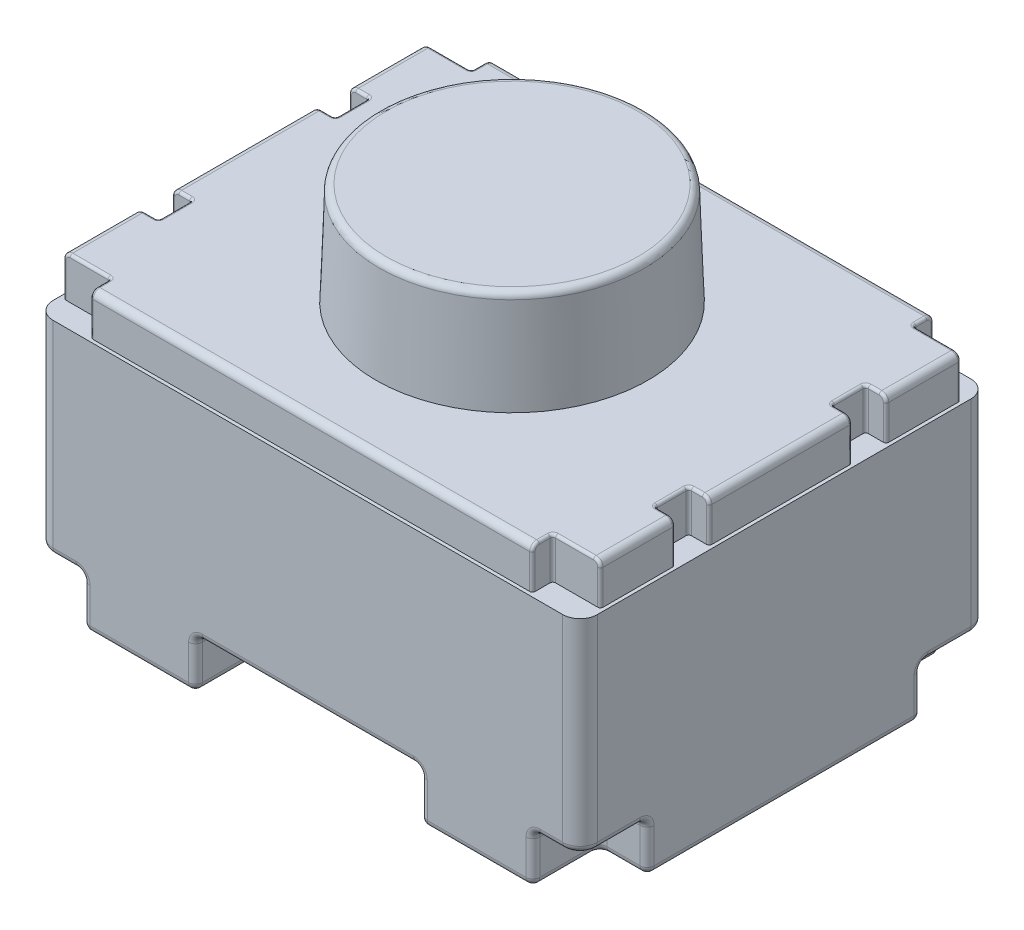
from build123d import *

# Parameters (mm, degrees)
BOSS_EXTRUDE1_START = 0.5588
SKETCH1_W           = 4
SKETCH1_H           = 3
BOSS_EXTRUDE1_DEPTH = 1.5
FILLET1_R           = 0.127
BOSS_EXTRUDE2_DEPTH = 0.3048
BOSS_EXTRUDE3_REACH = 5.64
BOSS_EXTRUDE3_START = 0.2
SKETCH5_R           = 1
BOSS_EXTRUDE5_DEPTH = 0.75
BOSS_EXTRUDE5_TAPER = 2
FILLET3_R           = 0.0508
CUT_EXTRUDE1_START  = -0.3048
SKETCH6_W           = 0.15
SKETCH6_H           = 0.25
CUT_EXTRUDE1_DEPTH  = 0.3048
FILLET4_R           = 0.02
FILLET5_R           = 0.05


with BuildPart() as part:
    # Sketch1 → Boss-Extrude1 (new body)
    with BuildSketch(Plane(origin=(0, 0, 0), x_dir=(1, 0, 0), z_dir=(0, 1, 0)).offset(BOSS_EXTRUDE1_START)):
        Rectangle(SKETCH1_W, SKETCH1_H)
    extrude(amount=BOSS_EXTRUDE1_DEPTH)

    # Fillet1
    fillet1_edges = [part.edges().sort_by_distance(p)[0] for p in [
        (2, 1.3088, 1.5),
        (-2, 1.3088, 1.5),
        (-2, 1.3088, -1.5),
        (2, 1.3088, -1.5),
    ]]
    fillet(fillet1_edges, radius=FILLET1_R)

    # Sketch2 → Boss-Extrude2 (add)
    with BuildSketch(Plane(origin=(0, 2.0588, 0), x_dir=(-1, 0, 0), z_dir=(0, -1, 0))):
        with BuildLine():
            Line((1.9746, -1.373), (1.9746, 1.373))
            ThreePointArc((1.9746, 1.373), (1.944842049, 1.444842049), (1.873, 1.4746))
            Line((1.873, 1.4746), (-1.873, 1.4746))
            ThreePointArc((-1.873, 1.4746), (-1.944842049, 1.444842049), (-1.9746, 1.373))
            Line((-1.9746, 1.373), (-1.9746, -1.373))
            ThreePointArc((-1.9746, -1.373), (-1.944842049, -1.444842049), (-1.873, -1.4746))
            Line((-1.873, -1.4746), (1.873, -1.4746))
            ThreePointArc((1.873, -1.4746), (1.944842049, -1.444842049), (1.9746, -1.373))
        make_face()
    extrude(amount=-BOSS_EXTRUDE2_DEPTH)

    # Sketch3 → Boss-Extrude3 (add, up to next)
    with BuildSketch(Plane(origin=(0, 0, 0), x_dir=(1, 0, 0), z_dir=(0, 1, 0)).offset(BOSS_EXTRUDE3_START), mode=Mode.PRIVATE) as boss_extrude3_sk1:
        Polygon((-1.65323541, -1.5), (-1.65323541, -1.006902093), (-2, -1.006902093), (-2, 1.006902093), (-1.65323541, 1.006902093), (-1.65323541, 1.5), (-0.826439501, 1.5), (-0.826439501, 0.473804959), (-1.582835796, 0.473804959), (-1.582835796, -0.473804959), (-0.826439501, -0.473804959), (-0.826439501, -1.5), align=None)
    boss_extrude3_tool1 = extrude(boss_extrude3_sk1.sketch, amount=BOSS_EXTRUDE3_REACH, mode=Mode.PRIVATE) - part.part
    # Sketch3 → Boss-Extrude3 (add, up to next)
    with BuildSketch(Plane(origin=(0, 0, 0), x_dir=(1, 0, 0), z_dir=(0, 1, 0)).offset(BOSS_EXTRUDE3_START), mode=Mode.PRIVATE) as boss_extrude3_sk2:
        Polygon((1.65323541, 1.5), (1.65323541, 1.006902093), (2, 1.006902093), (2, -1.006902093), (1.65323541, -1.006902093), (1.65323541, -1.5), (0.826439501, -1.5), (0.826439501, -0.473804959), (1.582835796, -0.473804959), (1.582835796, 0.473804959), (0.826439501, 0.473804959), (0.826439501, 1.5), align=None)
    boss_extrude3_tool2 = extrude(boss_extrude3_sk2.sketch, amount=BOSS_EXTRUDE3_REACH, mode=Mode.PRIVATE) - part.part
    add(boss_extrude3_tool1.solids().sort_by_distance((-1.621022, 0.2, 1.253451))[0])
    add(boss_extrude3_tool2.solids().sort_by_distance((1.621022, 0.2, -1.253451))[0])

    # Sketch5 → Boss-Extrude5 (add)
    with BuildSketch(Plane(origin=(0, 2.3636, 0), x_dir=(1, 0, 0), z_dir=(0, 1, 0))):
        Circle(SKETCH5_R)
    extrude(amount=BOSS_EXTRUDE5_DEPTH, taper=BOSS_EXTRUDE5_TAPER)

    # Fillet3
    fillet3_edges = [part.edges().sort_by_distance(p)[0] for p in [
        (0.826439501, 0.5588, -0.98690248),
        (0.826439501, 0.3794, -1.5),
        (0.826439501, 0.2, -0.98690248),
        (1.204637649, 0.5588, -0.473804959),
        (0.826439501, 0.3794, -0.473804959),
        (1.204637649, 0.2, -0.473804959),
        (1.582835796, 0.5588, 0),
        (1.582835796, 0.3794, -0.473804959),
        (1.582835796, 0.2, 0),
        (1.204637649, 0.5588, 0.473804959),
        (1.582835796, 0.3794, 0.473804959),
        (1.204637649, 0.2, 0.473804959),
        (0.826439501, 0.5588, 0.98690248),
        (0.826439501, 0.3794, 0.473804959),
        (0.826439501, 0.2, 0.98690248),
        (0.826439501, 0.3794, 1.5),
        (1.239837456, 0.2, 1.5),
        (1.65323541, 0.5588, 1.253451047),
        (1.65323541, 0.3794, 1.5),
        (1.65323541, 0.2, 1.253451047),
        (1.826617705, 0.5588, 1.006902093),
        (1.65323541, 0.3794, 1.006902093),
        (1.826617705, 0.2, 1.006902093),
        (2, 0.3794, 1.006902093),
        (2, 0.2, 0),
        (1.826617705, 0.5588, -1.006902093),
        (2, 0.3794, -1.006902093),
        (1.826617705, 0.2, -1.006902093),
        (1.65323541, 0.3794, -1.5),
        (1.239837456, 0.2, -1.5),
        (1.65323541, 0.5588, -1.253451047),
        (1.65323541, 0.3794, -1.006902093),
        (1.65323541, 0.2, -1.253451047),
        (-1.763117705, 0.5588, 1.5),
        (2, 0.5588, 1.189951047),
        (-2, 0.5588, -1.189951047),
        (1.763117705, 0.5588, -1.5),
        (1.962802561, 0.5588, 1.462802561),
        (1.962802561, 0.5588, -1.462802561),
        (-1.962802561, 0.5588, -1.462802561),
        (-1.962802561, 0.5588, 1.462802561),
        (-1.944842049, 2.3636, 1.444842049),
        (0, 2.3636, 1.4746),
        (1.944842049, 2.3636, 1.444842049),
        (1.9746, 2.3636, 0),
        (1.944842049, 2.3636, -1.444842049),
        (0, 2.3636, -1.4746),
        (-1.944842049, 2.3636, -1.444842049),
        (-1.9746, 2.3636, 0),
        (0, 0.5588, 1.5),
        (-2, 0.5588, 1.189951047),
        (-1.763117705, 0.5588, -1.5),
        (-0.826439501, 0.5588, 0.98690248),
        (-0.826439501, 0.3794, 1.5),
        (-0.826439501, 0.2, 0.98690248),
        (-1.204637649, 0.5588, 0.473804959),
        (-0.826439501, 0.3794, 0.473804959),
        (-1.204637649, 0.2, 0.473804959),
        (-1.582835796, 0.5588, 0),
        (-1.582835796, 0.3794, 0.473804959),
        (-1.582835796, 0.2, 0),
        (-1.204637649, 0.5588, -0.473804959),
        (-1.582835796, 0.3794, -0.473804959),
        (-1.204637649, 0.2, -0.473804959),
        (-0.826439501, 0.5588, -0.98690248),
        (-0.826439501, 0.3794, -0.473804959),
        (-0.826439501, 0.2, -0.98690248),
        (-0.826439501, 0.3794, -1.5),
        (-1.239837456, 0.2, -1.5),
        (-1.65323541, 0.5588, -1.253451047),
        (-1.65323541, 0.3794, -1.5),
        (-1.65323541, 0.2, -1.253451047),
        (-1.826617705, 0.5588, -1.006902093),
        (-1.65323541, 0.3794, -1.006902093),
        (-1.826617705, 0.2, -1.006902093),
        (-2, 0.3794, -1.006902093),
        (-2, 0.2, 0),
        (-1.826617705, 0.5588, 1.006902093),
        (-2, 0.3794, 1.006902093),
        (-1.826617705, 0.2, 1.006902093),
        (-1.65323541, 0.3794, 1.5),
        (-1.239837456, 0.2, 1.5),
        (-1.65323541, 0.5588, 1.253451047),
        (-1.65323541, 0.3794, 1.006902093),
        (-1.65323541, 0.2, 1.253451047),
        (0, 0.5588, -1.5),
        (2, 0.5588, -1.189951047),
        (1.763117705, 0.5588, 1.5),
    ]]
    fillet(fillet3_edges, radius=FILLET3_R)

    # Sketch6 → Cut-Extrude1 (cut)
    with BuildSketch(Plane(origin=(0, 2.3636, 0), x_dir=(1, 0, 0), z_dir=(0, 1, 0)).offset(CUT_EXTRUDE1_START)):
        with Locations((-1.8996, 0.65)):
            Rectangle(SKETCH6_W, SKETCH6_H)
        with BuildLine():
            Line((-1.6246, 1.3246), (-1.9746, 1.3246))
            Line((-1.9746, 1.3246), (-1.9746, 1.373))
            ThreePointArc((-1.9746, 1.373), (-1.944842049, 1.444842049), (-1.873, 1.4746))
            Line((-1.873, 1.4746), (-1.6246, 1.4746))
            Line((-1.6246, 1.4746), (-1.6246, 1.3246))
        make_face()
        with BuildLine():
            Line((1.9746, 1.3246), (1.9746, 1.373))
            ThreePointArc((1.9746, 1.373), (1.944842049, 1.444842049), (1.873, 1.4746))
            Line((1.873, 1.4746), (1.6246, 1.4746))
            Line((1.6246, 1.4746), (1.6246, 1.3246))
            Line((1.6246, 1.3246), (1.9746, 1.3246))
        make_face()
        with Locations((1.8996, 0.65)):
            Rectangle(SKETCH6_W, SKETCH6_H)
        with Locations((1.8996, -0.65)):
            Rectangle(SKETCH6_W, SKETCH6_H)
        with BuildLine():
            Line((1.6246, -1.3246), (1.9746, -1.3246))
            Line((1.9746, -1.3246), (1.9746, -1.373))
            ThreePointArc((1.9746, -1.373), (1.944842049, -1.444842049), (1.873, -1.4746))
            Line((1.873, -1.4746), (1.6246, -1.4746))
            Line((1.6246, -1.4746), (1.6246, -1.3246))
        make_face()
        with BuildLine():
            Line((-1.9746, -1.3246), (-1.9746, -1.373))
            ThreePointArc((-1.9746, -1.373), (-1.944842049, -1.444842049), (-1.873, -1.4746))
            Line((-1.873, -1.4746), (-1.6246, -1.4746))
            Line((-1.6246, -1.4746), (-1.6246, -1.3246))
            Line((-1.6246, -1.3246), (-1.9746, -1.3246))
        make_face()
        with Locations((-1.8996, -0.65)):
            Rectangle(SKETCH6_W, SKETCH6_H)
    extrude(amount=CUT_EXTRUDE1_DEPTH, mode=Mode.SUBTRACT)

    # Fillet4
    fillet4_edges = [part.edges().sort_by_distance(p)[0] for p in [
        (-1.6246, 2.2112, 1.3246),
        (-1.6246, 2.1858, 1.4746),
        (-1.6246, 2.348721024, 1.459721024),
        (-1.6246, 2.3636, 1.3742),
        (-1.7742, 2.3636, 1.3246),
        (-1.959721024, 2.348721024, 1.3246),
        (-1.9746, 2.1858, 1.3246),
        (-1.9746, 2.1858, 0.525),
        (-1.959721024, 2.348721024, 0.525),
        (-1.8742, 2.3636, 0.525),
        (-1.8246, 2.2112, 0.525),
        (-1.8246, 2.3636, 0.65),
        (-1.8246, 2.2112, 0.775),
        (-1.8742, 2.3636, 0.775),
        (-1.959721024, 2.348721024, 0.775),
        (-1.9746, 2.1858, 0.775),
        (-1.9746, 2.1858, -0.525),
        (-1.959721024, 2.348721024, -0.525),
        (-1.8742, 2.3636, -0.525),
        (-1.8246, 2.2112, -0.525),
        (-1.8246, 2.3636, -0.65),
        (-1.8246, 2.2112, -0.775),
        (-1.8742, 2.3636, -0.775),
        (-1.959721024, 2.348721024, -0.775),
        (-1.9746, 2.1858, -0.775),
        (-1.9746, 2.1858, -1.3246),
        (-1.959721024, 2.348721024, -1.3246),
        (-1.7742, 2.3636, -1.3246),
        (-1.6246, 2.2112, -1.3246),
        (-1.6246, 2.3636, -1.3742),
        (-1.6246, 2.348721024, -1.459721024),
        (-1.6246, 2.1858, -1.4746),
        (1.6246, 2.1858, -1.4746),
        (1.6246, 2.348721024, -1.459721024),
        (1.6246, 2.3636, -1.3742),
        (1.9746, 2.1858, -1.3246),
        (1.959721024, 2.348721024, -1.3246),
        (1.7742, 2.3636, -1.3246),
        (1.6246, 2.2112, -1.3246),
        (1.8246, 2.2112, -0.775),
        (1.9746, 2.1858, -0.775),
        (1.959721024, 2.348721024, -0.775),
        (1.8742, 2.3636, -0.775),
        (1.8246, 2.3636, -0.65),
        (1.9746, 2.1858, -0.525),
        (1.8742, 2.3636, -0.525),
        (1.959721024, 2.348721024, -0.525),
        (1.8246, 2.2112, -0.525),
        (1.9746, 2.1858, 0.525),
        (1.8742, 2.3636, 0.525),
        (1.959721024, 2.348721024, 0.525),
        (1.8246, 2.2112, 0.525),
        (1.8246, 2.3636, 0.65),
        (1.9746, 2.1858, 1.3246),
        (1.6246, 2.1858, 1.4746),
        (1.959721024, 2.348721024, 0.775),
        (1.8742, 2.3636, 0.775),
        (1.8246, 2.2112, 0.775),
        (1.9746, 2.1858, 0.775),
        (1.6246, 2.2112, 1.3246),
        (1.6246, 2.3636, 1.3742),
        (1.7742, 2.3636, 1.3246),
    ]]
    fillet(fillet4_edges, radius=FILLET4_R)

    # Fillet5
    fillet5_edges = [part.edges().sort_by_distance(p)[0] for p in [
        (-0.973809423, 3.1136, 0),
    ]]
    fillet(fillet5_edges, radius=FILLET5_R)


solid = part.part
